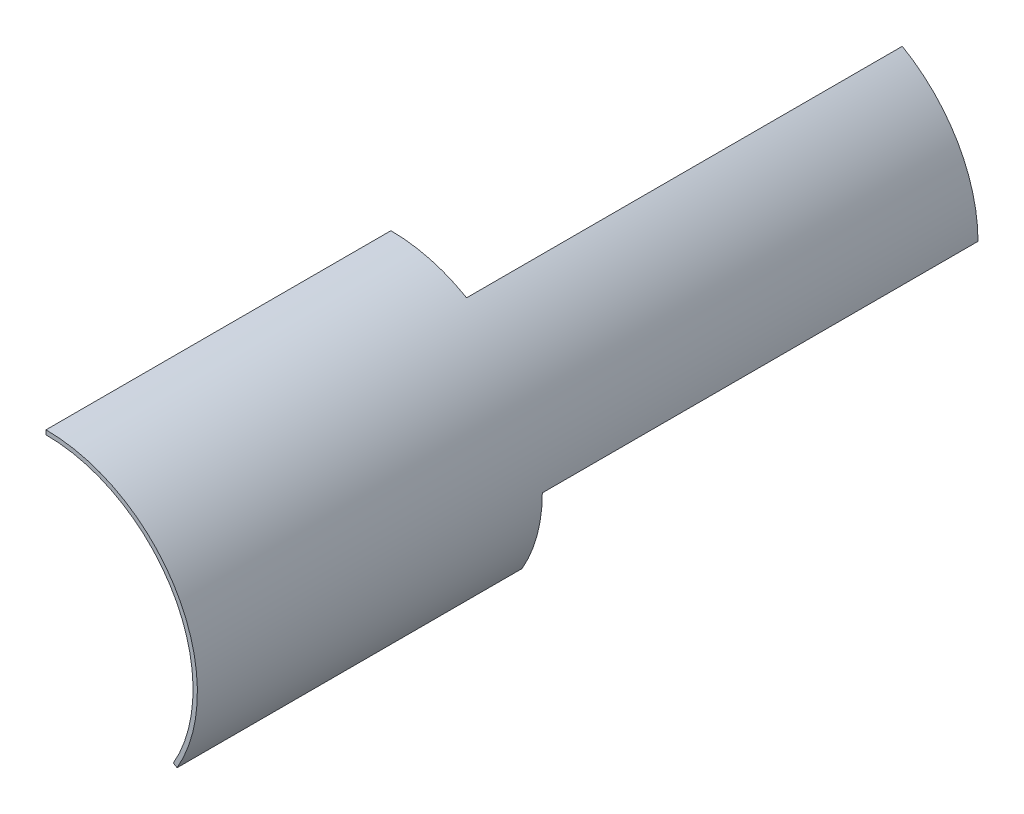
from build123d import *

# Parameters (mm, degrees)
REVOLVE_1_ANGLE           = 120.00000000000027
REVOLVE_2_ANGLE           = 30.000000000000068
REVOLVE_2_OTHER_WAY_ANGLE = 30.000000000000068


with BuildPart() as part:
    # Эскиз1 → Повернуть1 (revolve)
    with BuildSketch(Plane(origin=(0, 0, 0), x_dir=(0, 0, -1), z_dir=(1, 0, 0))):
        Polygon((-2e-17, 41.7), (-4.23e-15, 40.5), (95, 40.5), (95, 41.70000000000002), align=None)
    revolve(axis=Axis((0, 0, 0), (0, 0, -1)), revolution_arc=REVOLVE_1_ANGLE)

    # Эскиз3 → Повернуть2 (revolve)
    with BuildSketch(Plane(origin=(0, 0, 0), x_dir=(0, 0, 1), z_dir=(0.499999999999998, -0.8660254037844398, 0))):
        Polygon((-95, -40.500000000000014), (-215, -40.50000000000003), (-215, -41.70000000000003), (-95, -41.700000000000024), align=None)
    revolve(axis=Axis((0, 0, -95), (0, 0, 1)), revolution_arc=REVOLVE_2_ANGLE)

    # Эскиз3 → Повернуть2 other way (revolve)
    with BuildSketch(Plane(origin=(0, 0, 0), x_dir=(0, 0, 1), z_dir=(0.499999999999998, -0.8660254037844398, 0))):
        Polygon((-95, -40.500000000000014), (-215, -40.50000000000003), (-215, -41.70000000000003), (-95, -41.700000000000024), align=None)
    revolve(axis=Axis((0, 0, -95), (0, 0, -1)), revolution_arc=REVOLVE_2_OTHER_WAY_ANGLE)


solid = part.part
